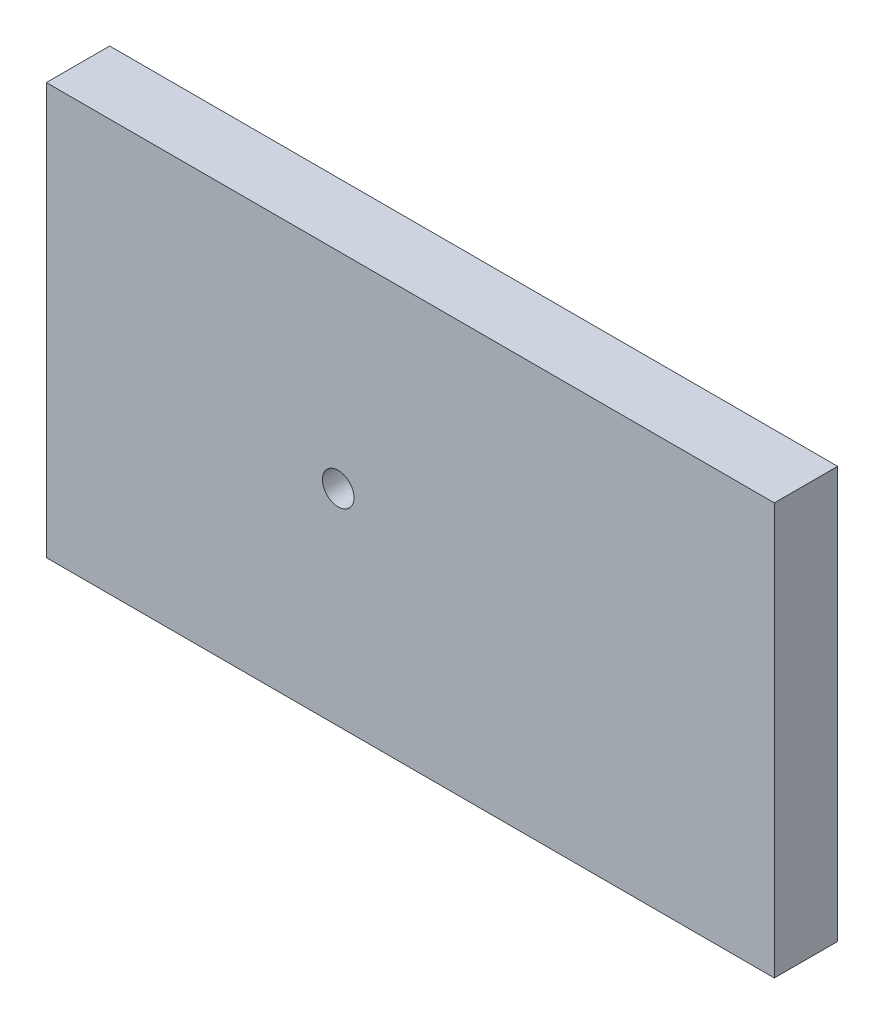
from build123d import *

# Parameters (mm, degrees)
ESQUISSE1_W        = 146.05
ESQUISSE1_H        = 82.55
ESQUISSE1_R        = 3.175
BOSS_EXTRU_1_DEPTH = 12.7


with BuildPart() as part:
    # Esquisse1 → Boss.-Extru.1 (new body)
    with BuildSketch(Plane.XY):
        Rectangle(ESQUISSE1_W, ESQUISSE1_H)
        with Locations((-14.475000006, 0)):
            Circle(ESQUISSE1_R, mode=Mode.SUBTRACT)
    extrude(amount=BOSS_EXTRU_1_DEPTH)


solid = part.part
